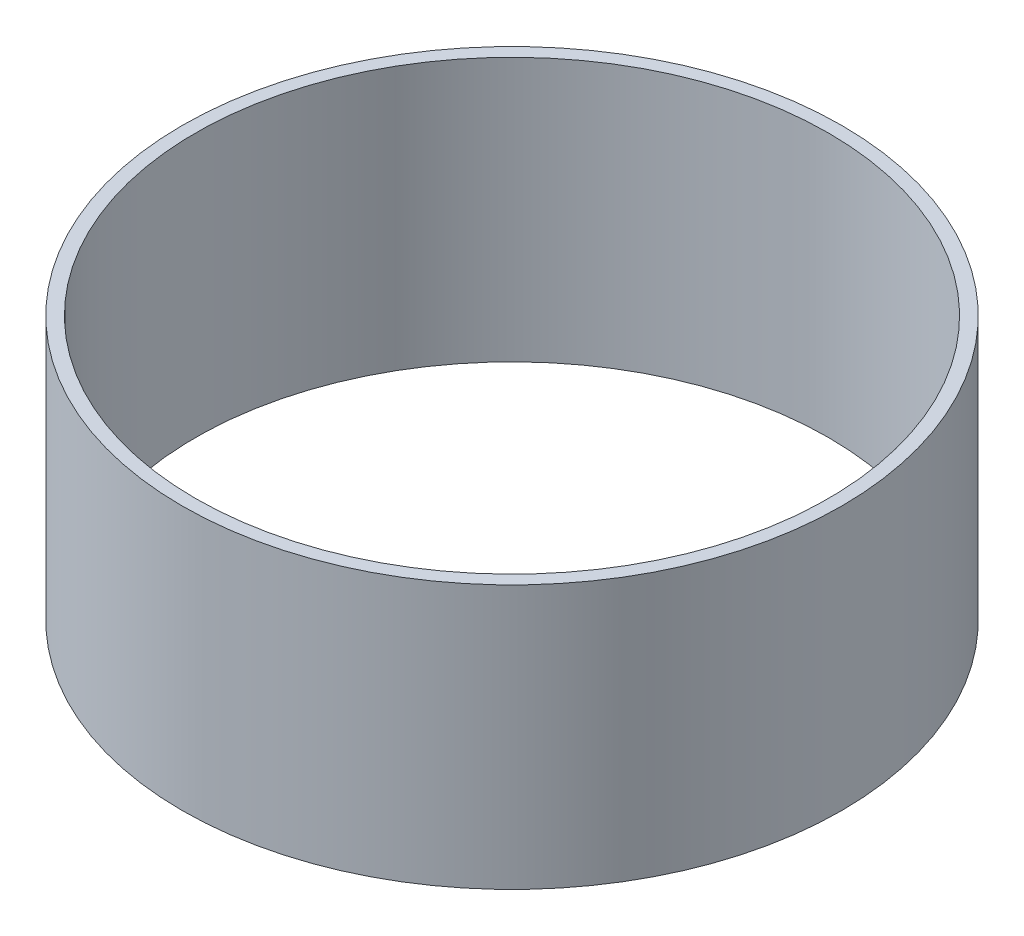
from build123d import *

# Parameters (mm, degrees)
SKETCH_1_R      = 12.5
SKETCH_1_R_2    = 12
EXTRUDE_1_DEPTH = 10


with BuildPart() as part:
    # 草图1 → 凸台-拉伸1 (new body)
    with BuildSketch(Plane(origin=(0, 0, 0), x_dir=(1, 0, 0), z_dir=(0, 1, 0))):
        with Locations(Location((0, 0, 0), (0, 0, 270))):
            Circle(SKETCH_1_R)
        with Locations(Location((0, 0, 0), (0, 0, 270))):
            Circle(SKETCH_1_R_2, mode=Mode.SUBTRACT)
    extrude(amount=EXTRUDE_1_DEPTH)


solid = part.part
